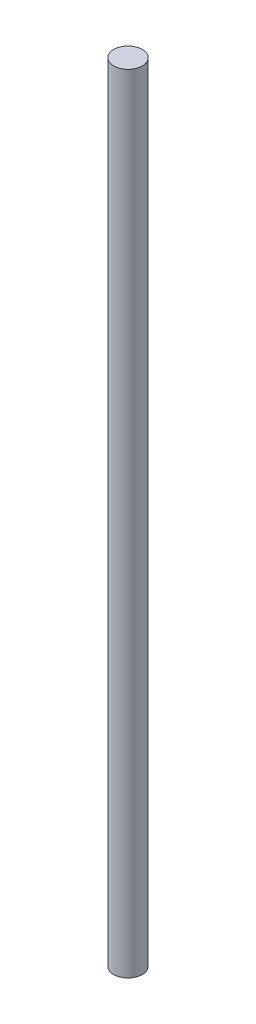
from build123d import *

# Parameters (mm, degrees)
CROQUIS1_R              = 3
SALIENTE_EXTRUIR1_DEPTH = 165


with BuildPart() as part:
    # Croquis1 → Saliente-Extruir1 (new body)
    with BuildSketch(Plane(origin=(0, 0, 0), x_dir=(1, 0, 0), z_dir=(0, 1, 0))):
        with Locations(Location((0, 0, 0), (0, 0, 270))):
            Circle(CROQUIS1_R)
    extrude(amount=SALIENTE_EXTRUIR1_DEPTH)


solid = part.part
